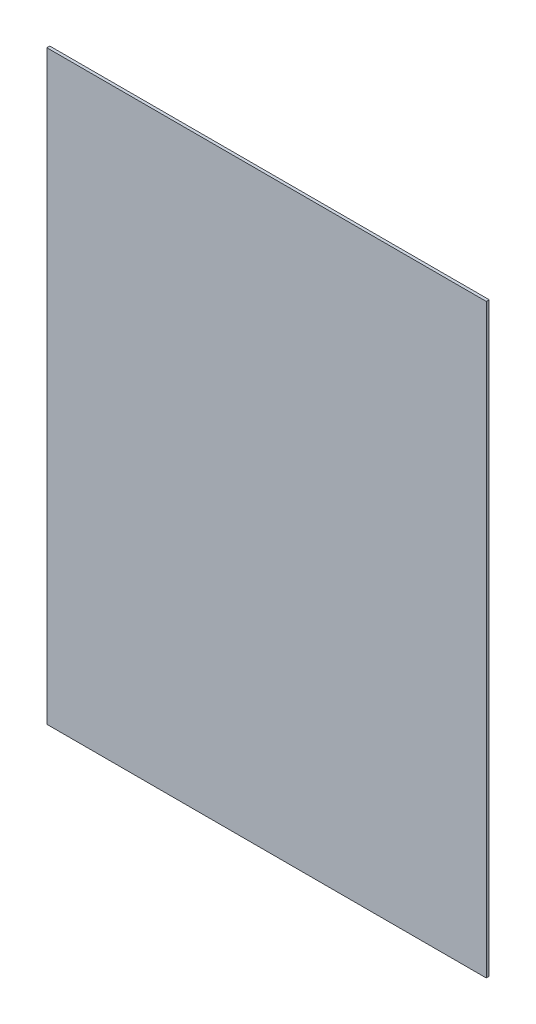
from build123d import *

# Parameters (mm, degrees)
SKETCH1_W           = 300
SKETCH1_H           = 400
BOSS_EXTRUDE1_DEPTH = 2


with BuildPart() as part:
    # Sketch1 → Boss-Extrude1 (new body)
    with BuildSketch(Plane.XY):
        with Locations((-191.463414634, 54.355400697)):
            Rectangle(SKETCH1_W, SKETCH1_H)
    extrude(amount=BOSS_EXTRUDE1_DEPTH)


solid = part.part
